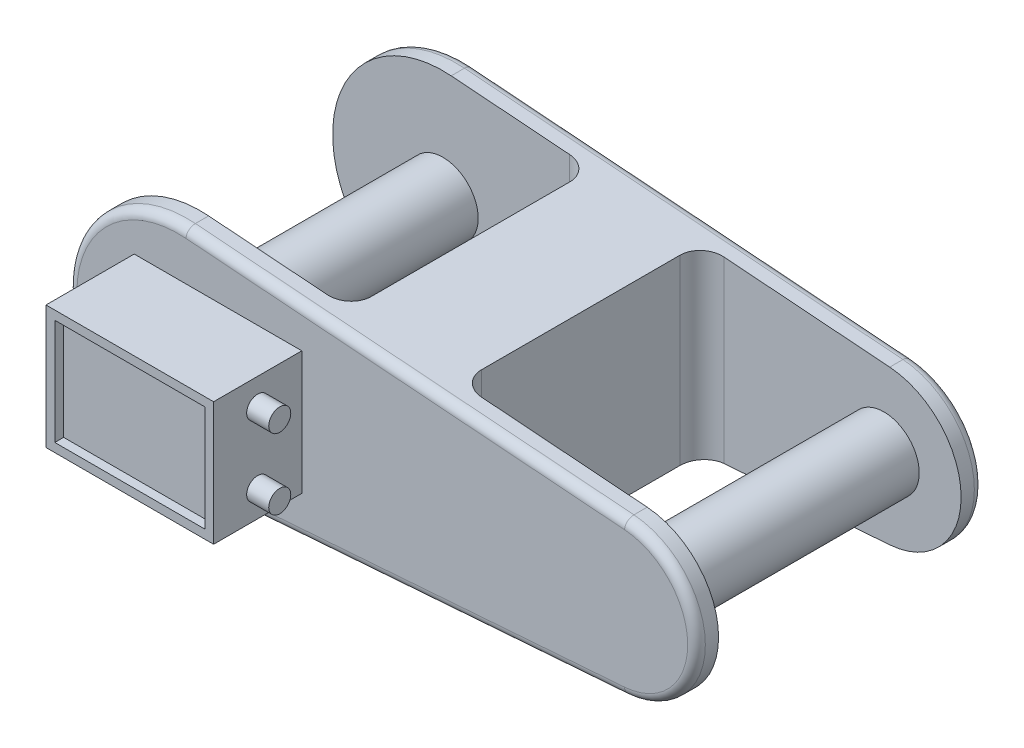
from build123d import *

# Parameters (mm, degrees)
Y_KSEKLIK_EKSTR_ZYON1_DEPTH = 32.5
KES_EKSTR_ZYON1_DEPTH       = 125.448784647
KES_EKSTR_ZYON1_DEPTH_BACK  = 125.448784647
IZIM3_W                     = 58.75
IZIM3_H                     = 55
IZIM4_R                     = 8
Y_KSEKLIK_EKSTR_ZYON2_DEPTH = 32.5
RADYUS1_R                   = 5
IZIM5_W                     = 38
IZIM5_H                     = 28
Y_KSEKLIK_EKSTR_ZYON3_DEPTH = 20
IZIM6_R                     = 2.5
Y_KSEKLIK_EKSTR_ZYON4_DEPTH = 5
IZIM7_W                     = 34
IZIM7_H                     = 24
KES_EKSTR_ZYON2_DEPTH       = 2
RADYUS2_R                   = 2


with BuildPart() as part:
    # Çizim1 → Yükseklik-Ekstrüzyon1 (new, symmetric)
    with BuildSketch(Plane.XY):
        with BuildLine():
            Line((1.875, 24.929588344), (101.3125, 17.450711841))
            ThreePointArc((101.3125, 17.450711841), (117.5, 0), (101.3125, -17.450711841))
            Line((101.3125, -17.450711841), (1.875, -24.929588344))
            ThreePointArc((1.875, -24.929588344), (-25, 0), (1.875, 24.929588344))
        make_face()
    extrude(amount=Y_KSEKLIK_EKSTR_ZYON1_DEPTH, both=True)

    # Çizim3 → Kes-Ekstrüzyon1 (cut, two sides: drawn at the far end of the back side and taken through both)
    with BuildSketch(Plane(origin=(0, 0, 0), x_dir=(1, 0, 0), z_dir=(0, 1, 0)).offset(-KES_EKSTR_ZYON1_DEPTH_BACK)):
        with Locations((4.375, 0)):
            Rectangle(IZIM3_W, IZIM3_H)
        with Locations((88.125, 0)):
            Rectangle(IZIM3_W, IZIM3_H)
    extrude(amount=KES_EKSTR_ZYON1_DEPTH + KES_EKSTR_ZYON1_DEPTH_BACK, mode=Mode.SUBTRACT)

    # Çizim4 → Yükseklik-Ekstrüzyon2 (add, symmetric)
    with BuildSketch(Plane.XY):
        with Locations(Location((0, 0, 0), (0, 0, 180))):
            Circle(IZIM4_R)
        with Locations(Location((100, 0, 0), (0, 0, 180))):
            Circle(IZIM4_R)
    extrude(amount=Y_KSEKLIK_EKSTR_ZYON2_DEPTH, both=True)

    # Radyus1
    radyus1_edges = [part.edges().sort_by_distance(p)[0] for p in [
        (33.75, 0, -27.5),
        (33.75, 0, 27.5),
        (58.75, 0, 27.5),
        (58.75, 0, -27.5),
    ]]
    fillet(radyus1_edges, radius=RADYUS1_R)

    # Radyus2
    radyus2_edges = [part.edges().sort_by_distance(p)[0] for p in [
        (117.5, 0, 32.5),
        (51.59375, 21.190150092, 32.5),
        (-25, 0, 32.5),
        (51.59375, 21.190150092, -32.5),
        (117.5, 0, -32.5),
        (51.59375, -21.190150092, -32.5),
        (-25, 0, -32.5),
        (51.59375, -21.190150092, 32.5),
    ]]
    fillet(radyus2_edges, radius=RADYUS2_R)


with BuildPart() as body_2:
    # Çizim5 → Yükseklik-Ekstrüzyon3 (new body)
    with BuildSketch(Plane.XY.offset(32.5)):
        with Locations((9, 0)):
            Rectangle(IZIM5_W, IZIM5_H)
    extrude(amount=Y_KSEKLIK_EKSTR_ZYON3_DEPTH)

    # Çizim6 → Yükseklik-Ekstrüzyon4 (add)
    with BuildSketch(Plane(origin=(28, 0, 0), x_dir=(0, 0, -1), z_dir=(1, 0, 0))):
        with Locations(Location((-42.5, 8, 0), (0, 0, 180))):
            Circle(IZIM6_R)
        with Locations(Location((-42.5, -8, 0), (0, 0, 180))):
            Circle(IZIM6_R)
    extrude(amount=Y_KSEKLIK_EKSTR_ZYON4_DEPTH)

    # Çizim7 → Kes-Ekstrüzyon2 (cut)
    with BuildSketch(Plane.XY.offset(52.5)):
        with Locations((9, 0)):
            Rectangle(IZIM7_W, IZIM7_H)
    extrude(amount=-KES_EKSTR_ZYON2_DEPTH, mode=Mode.SUBTRACT)


solid = Compound([part.part, body_2.part])
